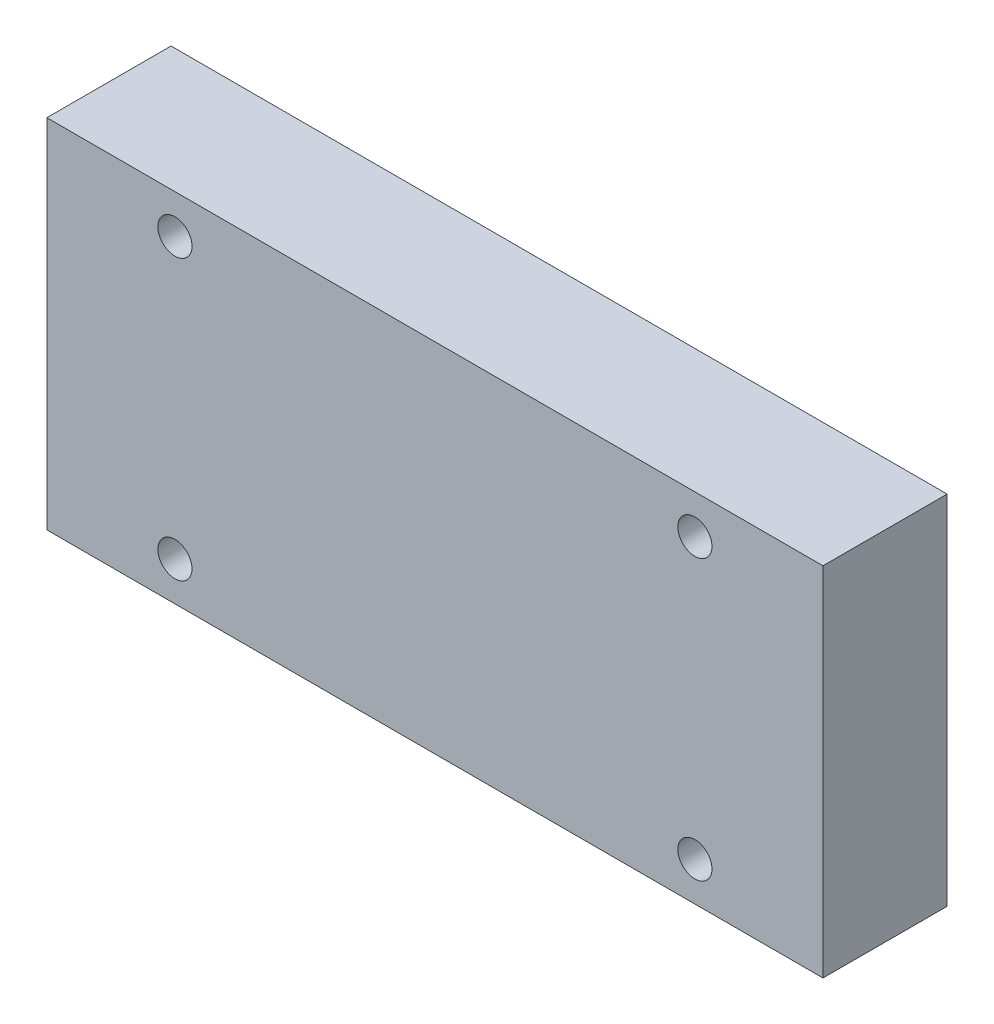
from build123d import *

# Parameters (mm, degrees)
SKETCH1_W           = 50
SKETCH1_H           = 23
SKETCH1_R           = 1.1
BOSS_EXTRUDE1_DEPTH = 8


with BuildPart() as part:
    # Sketch1 → Boss-Extrude1 (new body)
    with BuildSketch(Plane.XY):
        Rectangle(SKETCH1_W, SKETCH1_H)
        with Locations((-16.75, 9)):
            Circle(SKETCH1_R, mode=Mode.SUBTRACT)
        with Locations(Location((16.75, 9, 0), (0, 0, 180))):
            Circle(SKETCH1_R, mode=Mode.SUBTRACT)
        with Locations(Location((-16.75, -9, 0), (0, 0, 180))):
            Circle(SKETCH1_R, mode=Mode.SUBTRACT)
        with Locations((16.75, -9)):
            Circle(SKETCH1_R, mode=Mode.SUBTRACT)
    extrude(amount=BOSS_EXTRUDE1_DEPTH)


solid = part.part
